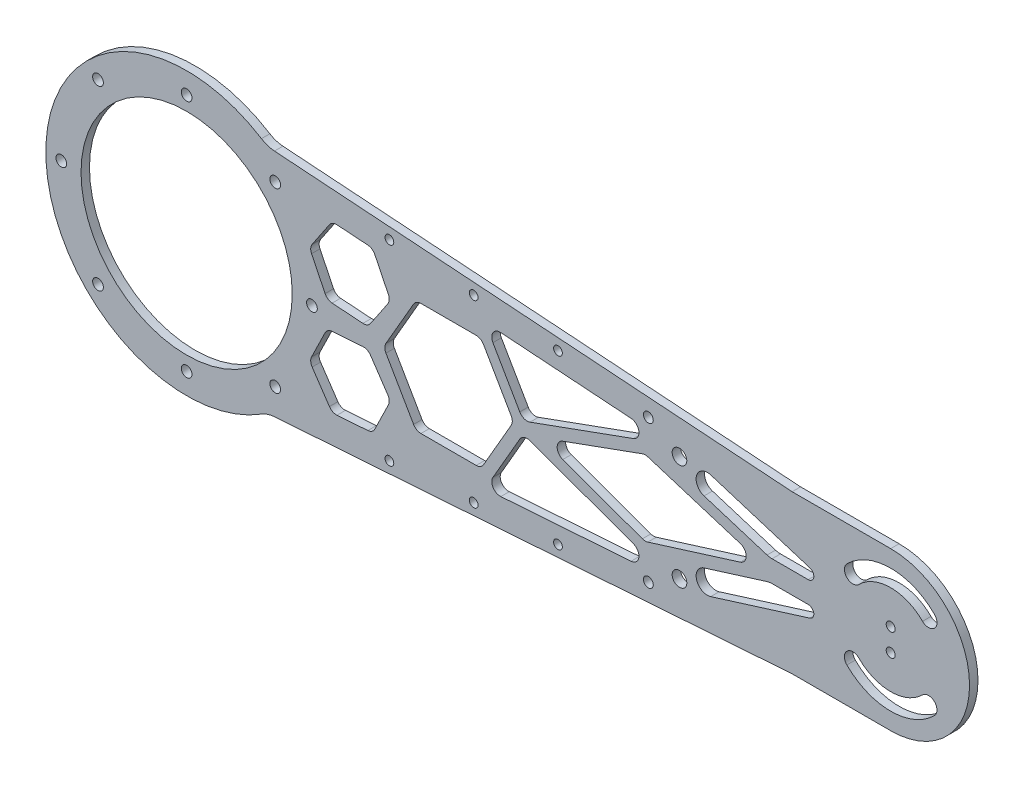
from build123d import *

# Parameters (mm, degrees)
EXTRUDE_1_DEPTH      = 3
SKETCH_3_R           = 1.6
CUT_EXTRUDE_2_DEPTH  = 10
SKETCH_5_R           = 1.55
CUT_EXTRUDE_4_DEPTH  = 10
CUT_EXTRUDE_7_DEPTH  = 9
SKETCH_9_R           = 2.6
CUT_EXTRUDE_8_DEPTH  = 26.2
CUT_EXTRUDE_9_DEPTH  = 10
SKETCH_2_R           = 37.5
SKETCH_2_R_2         = 1.9
CUT_EXTRUDE_12_DEPTH = 10
SKETCH_13_R          = 1.75
CUT_EXTRUDE_13_DEPTH = 10
EXTRUDE_3_DEPTH      = 3
CUT_EXTRUDE_17_DEPTH = 3
CUT_EXTRUDE_20_DEPTH = 58
FILLET_2_R           = 2
FILLET_3_R           = 6


with BuildPart() as part:
    # 草图1 → 凸台-拉伸1 (new body)
    with BuildSketch(Plane.XY):
        with BuildLine():
            ThreePointArc((250, -28), (278, 0), (250, 28))
            Line((250, 28), (215.69841539, 28))
            Line((215.69841539, 28), (215.349207695, 28))
            Line((215.349207695, 28), (215, 28))
            Line((215, 28), (214.651642957, 28.024359497))
            Line((214.651642957, 28.024359497), (213.91342496, 28.075980729))
            Line((213.91342496, 28.075980729), (31.183070535, 40.853731859))
            ThreePointArc((31.183070535, 40.853731859), (28.782473703, 41.321407548), (26.56719606, 42.357810301))
            ThreePointArc((26.56719606, 42.357810301), (13.822255332, 48.051485487), (0, 50))
            ThreePointArc((0, 50), (-50, 0), (0, -50))
            ThreePointArc((0, -50), (13.822255332, -48.051485487), (26.56719606, -42.357810301))
            ThreePointArc((26.56719606, -42.357810301), (28.782473703, -41.321407548), (31.183070535, -40.853731859))
            Line((31.183070535, -40.853731859), (213.91342496, -28.075980729))
            Line((213.91342496, -28.075980729), (214.651642957, -28.024359497))
            Line((214.651642957, -28.024359497), (215, -28))
            Line((215, -28), (215.349207695, -28))
            Line((215.349207695, -28), (215.69841539, -28))
            Line((215.69841539, -28), (250, -28))
        make_face()
    extrude(amount=EXTRUDE_1_DEPTH)

    # 草图3 → 切除-拉伸2 (cut)
    with BuildSketch(Plane.XY.offset(3)):
        with Locations((250, 4)):
            Circle(SKETCH_3_R)
        with Locations((250, -4)):
            Circle(SKETCH_3_R)
    extrude(amount=-CUT_EXTRUDE_2_DEPTH, mode=Mode.SUBTRACT)

    # 草图5 → 切除-拉伸4 (cut)
    with BuildSketch(Plane.XY.offset(3)):
        with Locations((72, 33.989766516)):
            Circle(SKETCH_5_R)
        with Locations((101.926921508, 31.897072303)):
            Circle(SKETCH_5_R)
        with Locations((131.853843016, 29.804378091)):
            Circle(SKETCH_5_R)
        with Locations((131.853843016, -29.804378091)):
            Circle(SKETCH_5_R)
        with Locations((101.926921508, -31.897072303)):
            Circle(SKETCH_5_R)
        with Locations((72, -33.989766516)):
            Circle(SKETCH_5_R)
    extrude(amount=-CUT_EXTRUDE_4_DEPTH, mode=Mode.SUBTRACT)

    # 草图8 → 切除-拉伸7 (cut)
    with BuildSketch(Plane.XY.offset(3)):
        with BuildLine():
            ThreePointArc((238.686291502, 11.3137085), (250, 16), (261.313708499, 11.313708499))
            ThreePointArc((261.313708499, 11.313708499), (265.556349186, 11.313708499), (265.556349186, 15.556349186))
            ThreePointArc((265.556349186, 15.556349186), (250, 22), (234.443650814, 15.556349186))
            ThreePointArc((234.443650814, 15.556349186), (234.443650814, 11.313708499), (238.686291502, 11.3137085))
        make_face()
        with BuildLine():
            ThreePointArc((234.443650814, -15.556349186), (249.999999954, -22), (265.556349121, -15.556349251))
            ThreePointArc((265.556349121, -15.556349251), (265.556349203, -11.313708516), (261.313708468, -11.31370853))
            ThreePointArc((261.313708468, -11.31370853), (249.999999987, -16), (238.686291514, -11.313708512))
            ThreePointArc((238.686291514, -11.313708512), (234.44365082, -11.313708493), (234.443650814, -15.556349186))
        make_face()
    extrude(amount=-CUT_EXTRUDE_7_DEPTH, mode=Mode.SUBTRACT)

    # 草图9 → 切除-拉伸8 (cut)
    with BuildSketch(Plane(origin=(0, 0, 0), x_dir=(-1, 0, 0), z_dir=(0, 0, -1))):
        with Locations((-174.999999373, 21.000004015)):
            Circle(SKETCH_9_R)
        with Locations((-174.999999373, -21.000004015)):
            Circle(SKETCH_9_R)
    extrude(amount=-CUT_EXTRUDE_8_DEPTH, mode=Mode.SUBTRACT)

    # 草图10 → 切除-拉伸9 (cut)
    with BuildSketch(Plane(origin=(0, 0, 0), x_dir=(-1, 0, 0), z_dir=(0, 0, -1))):
        with BuildLine():
            Line((-172.399999373, 21.000004015), (-172.399999373, 5.000004015))
            ThreePointArc((-172.399999373, 5.000004015), (-174.999999373, 2.400004015), (-177.599999373, 5.000004015))
            Line((-177.599999373, 5.000004015), (-177.599999373, 21.000004015))
            ThreePointArc((-177.599999373, 21.000004015), (-174.999999373, 23.600004015), (-172.399999373, 21.000004015))
        make_face()
    extrude(amount=-CUT_EXTRUDE_9_DEPTH, mode=Mode.SUBTRACT)

    # 草图2 → 切除-拉伸12 (cut)
    with BuildSketch(Plane.XY.offset(3)):
        Circle(SKETCH_2_R)
        with Locations((0, -42.5)):
            Circle(SKETCH_2_R_2)
        with Locations((-44.5, 0)):
            Circle(SKETCH_2_R_2)
        with Locations((-31.466251763, 31.466251763)):
            Circle(SKETCH_2_R_2)
        with Locations((0, 42.5)):
            Circle(SKETCH_2_R_2)
        with Locations((31.466251763, 31.466251763)):
            Circle(SKETCH_2_R_2)
        with Locations((44.5, 0)):
            Circle(SKETCH_2_R_2)
        with Locations((31.466251763, -31.466251763)):
            Circle(SKETCH_2_R_2)
        with Locations((-31.466251763, -31.466251763)):
            Circle(SKETCH_2_R_2)
    extrude(amount=-CUT_EXTRUDE_12_DEPTH, mode=Mode.SUBTRACT)

    # 草图13 → 切除-拉伸13 (cut)
    with BuildSketch(Plane.XY.offset(3)):
        with Locations((163.943843016, 25.342425399)):
            Circle(SKETCH_13_R)
        with Locations((163.943843016, -25.342425399)):
            Circle(SKETCH_13_R)
    extrude(amount=-CUT_EXTRUDE_13_DEPTH, mode=Mode.SUBTRACT)

    # 草图14 → 凸台-拉伸3 (add)
    with BuildSketch(Plane(origin=(0, 0, 0), x_dir=(-1, 0, 0), z_dir=(0, 0, -1))):
        with BuildLine():
            ThreePointArc((-172.399999373, 21.000004015), (-174.999999373, 23.600004015), (-177.599999373, 21.000004015))
            Line((-177.599999373, 21.000004015), (-177.599999373, 18.800004015))
            ThreePointArc((-177.599999373, 18.800004015), (-174.999999373, 21.400004015), (-172.399999373, 18.800004015))
            Line((-172.399999373, 18.800004015), (-172.399999373, 21.000004015))
        make_face()
        with BuildLine():
            ThreePointArc((-172.399999373, 18.800004015), (-174.999999373, 16.200004015), (-177.599999373, 18.800004015))
            Line((-177.599999373, 18.800004015), (-177.599999373, 5.000004015))
            ThreePointArc((-177.599999373, 5.000004015), (-174.999999373, 2.400004015), (-172.399999373, 5.000004015))
            Line((-172.399999373, 5.000004015), (-172.399999373, 18.800004015))
        make_face()
        with BuildLine():
            ThreePointArc((-177.355843171, -19.900004015), (-174.999999373, -23.600004015), (-172.644155575, -19.900004015))
            ThreePointArc((-172.644155575, -19.900004015), (-174.999999373, -21.400004015), (-177.355843171, -19.900004015))
        make_face()
    extrude(amount=-EXTRUDE_3_DEPTH)

    # 草图14<6> → 切除-拉伸17 (cut)
    with BuildSketch(Plane(origin=(0, 0, 0), x_dir=(-1, 0, 0), z_dir=(0, 0, -1))):
        with BuildLine():
            ThreePointArc((-172.399999373, -18.800004015), (-174.999999373, -16.200004015), (-177.599999373, -18.800004015))
            ThreePointArc((-177.599999373, -18.800004015), (-177.538226498, -19.363389374), (-177.355843171, -19.900004015))
            ThreePointArc((-177.355843171, -19.900004015), (-174.999999373, -18.400004015), (-172.644155575, -19.900004015))
            ThreePointArc((-172.644155575, -19.900004015), (-172.461772248, -19.363389374), (-172.399999373, -18.800004015))
        make_face()
    extrude(amount=-CUT_EXTRUDE_17_DEPTH, mode=Mode.SUBTRACT)

    # 草图15 → 切除-拉伸20 (cut)
    with BuildSketch(Plane(origin=(0, 0, 0), x_dir=(-1, 0, 0), z_dir=(0, 0, -1))):
        with BuildLine():
            ThreePointArc((-44.360684275, 15.873657787), (-44.064374263, 17.398040649), (-44.569953696, 18.866349938))
            Line((-44.569953696, 18.866349938), (-50.70410699, 27.960606186))
            ThreePointArc((-50.70410699, 27.960606186), (-51.876106267, 28.979409614), (-53.400489129, 29.275719626))
            Line((-53.400489129, 29.275719626), (-64.343422715, 28.510515167))
            ThreePointArc((-64.343422715, 28.510515167), (-65.811732004, 28.004935734), (-66.830535433, 26.832936457))
            Line((-66.830535433, 26.832936457), (-71.639315725, 16.97347575))
            ThreePointArc((-71.639315725, 16.97347575), (-71.935625737, 15.449092888), (-71.430046304, 13.980783599))
            Line((-71.430046304, 13.980783599), (-65.29589301, 4.886527351))
            ThreePointArc((-65.29589301, 4.886527351), (-64.123893733, 3.867723922), (-62.599510871, 3.571413911))
            Line((-62.599510871, 3.571413911), (-51.656577285, 4.33661837))
            ThreePointArc((-51.656577285, 4.33661837), (-50.188267996, 4.842197803), (-49.169464567, 6.01419708))
            Line((-49.169464567, 6.01419708), (-44.360684275, 15.873657787))
        make_face()
        with BuildLine():
            ThreePointArc((-44.569953696, -18.866349938), (-44.064374263, -17.398040649), (-44.360684275, -15.873657787))
            Line((-44.360684275, -15.873657787), (-49.169464567, -6.01419708))
            ThreePointArc((-49.169464567, -6.01419708), (-50.188267996, -4.842197803), (-51.656577285, -4.33661837))
            Line((-51.656577285, -4.33661837), (-62.599510871, -3.571413911))
            ThreePointArc((-62.599510871, -3.571413911), (-64.123893733, -3.867723922), (-65.29589301, -4.886527351))
            Line((-65.29589301, -4.886527351), (-71.430046304, -13.980783599))
            ThreePointArc((-71.430046304, -13.980783599), (-71.935625737, -15.449092888), (-71.639315725, -16.97347575))
            Line((-71.639315725, -16.97347575), (-66.830535433, -26.832936457))
            ThreePointArc((-66.830535433, -26.832936457), (-65.811732004, -28.004935734), (-64.343422715, -28.510515167))
            Line((-64.343422715, -28.510515167), (-53.400489129, -29.275719626))
            ThreePointArc((-53.400489129, -29.275719626), (-51.876106267, -28.979409614), (-50.70410699, -27.960606186))
            Line((-50.70410699, -27.960606186), (-44.569953696, -18.866349938))
        make_face()
        with BuildLine():
            ThreePointArc((-70.772014636, -1.5), (-70.370090848, 0), (-70.772014636, 1.5))
            Line((-70.772014636, 1.5), (-80.586969212, 18.5))
            ThreePointArc((-80.586969212, 18.5), (-81.685045424, 19.598076211), (-83.185045424, 20))
            Line((-83.185045424, 20), (-102.814954576, 20))
            ThreePointArc((-102.814954576, 20), (-104.314954576, 19.598076211), (-105.413030788, 18.5))
            Line((-105.413030788, 18.5), (-115.227985364, 1.5))
            ThreePointArc((-115.227985364, 1.5), (-115.629909152, 0), (-115.227985364, -1.5))
            Line((-115.227985364, -1.5), (-105.413030788, -18.5))
            ThreePointArc((-105.413030788, -18.5), (-104.314954576, -19.598076211), (-102.814954576, -20))
            Line((-102.814954576, -20), (-83.185045424, -20))
            ThreePointArc((-83.185045424, -20), (-81.685045424, -19.598076211), (-80.586969212, -18.5))
            Line((-80.586969212, -18.5), (-70.772014636, -1.5))
        make_face()
        with BuildLine():
            Line((-111.559689545, 25.208832156), (-157.807807687, 21.974848696))
            ThreePointArc((-157.807807687, 21.974848696), (-160.569606061, 19.397795995), (-158.621030344, 16.161782465))
            Line((-158.621030344, 16.161782465), (-121.921647755, 2.856870801))
            ThreePointArc((-121.921647755, 2.856870801), (-119.871311687, 2.85881682), (-118.301079465, 4.17724488))
            Line((-118.301079465, 4.17724488), (-108.752343913, 20.716140005))
            ThreePointArc((-108.752343913, 20.716140005), (-108.806275836, 23.805897798), (-111.559689545, 25.208832156))
        make_face()
        with BuildLine():
            ThreePointArc((-118.301079465, -4.17724488), (-119.871311687, -2.85881682), (-121.921647755, -2.856870801))
            Line((-121.921647755, -2.856870801), (-158.621030344, -16.161782465))
            ThreePointArc((-158.621030344, -16.161782465), (-160.569606061, -19.397795995), (-157.807807687, -21.974848696))
            Line((-157.807807687, -21.974848696), (-111.559689545, -25.208832156))
            ThreePointArc((-111.559689545, -25.208832156), (-108.806275836, -23.805897798), (-108.752343913, -20.716140005))
            Line((-108.752343913, -20.716140005), (-118.301079465, -4.17724488))
        make_face()
        with BuildLine():
            Line((-133.557009868, 2.82037408), (-161.826868428, 13.069265052))
            ThreePointArc((-161.826868428, 13.069265052), (-162.781242901, 13.248117538), (-163.742753214, 13.112778098))
            Line((-163.742753214, 13.112778098), (-196.596913162, 2.863887126))
            ThreePointArc((-196.596913162, 2.863887126), (-198.703520455, 0), (-196.596913162, -2.863887126))
            Line((-196.596913162, -2.863887126), (-163.742753214, -13.112778098))
            ThreePointArc((-163.742753214, -13.112778098), (-162.781242901, -13.248117538), (-161.826868428, -13.069265052))
            Line((-161.826868428, -13.069265052), (-133.557009868, -2.82037408))
            ThreePointArc((-133.557009868, -2.82037408), (-131.579501947, 0), (-133.557009868, 2.82037408))
        make_face()
        with BuildLine():
            Line((-183.718721561, -11.071362292), (-206.968668045, -3.818516168))
            Line((-206.968668045, -3.818516168), (-233.832554213, -3.818516168))
            Line((-233.832554213, -3.818516168), (-186.101102114, -18.708394627))
            ThreePointArc((-186.101102114, -18.708394627), (-181.09139567, -16.081068736), (-183.718721561, -11.071362292))
        make_face()
        with BuildLine():
            Line((-233.832554213, 3.818516168), (-206.968668045, 3.818516168))
            Line((-206.968668045, 3.818516168), (-183.718721561, 11.071362292))
            ThreePointArc((-183.718721561, 11.071362292), (-181.091395614, 16.081068754), (-186.101102114, 18.708394627))
            Line((-186.101102114, 18.708394627), (-233.832554213, 3.818516168))
        make_face()
    extrude(amount=-CUT_EXTRUDE_20_DEPTH, mode=Mode.SUBTRACT)

    # 圆角2
    fillet_2_edges = [part.edges().sort_by_distance(p)[0] for p in [
        (233.832554213, -3.818516168, 1.5),
        (233.832554213, 3.818516168, 1.5),
    ]]
    fillet(fillet_2_edges, radius=FILLET_2_R)

    # 圆角3
    fillet_3_edges = [part.edges().sort_by_distance(p)[0] for p in [
        (206.968668045, -3.818516168, 1.5),
        (206.968668045, 3.818516168, 1.5),
    ]]
    fillet(fillet_3_edges, radius=FILLET_3_R)


solid = part.part
